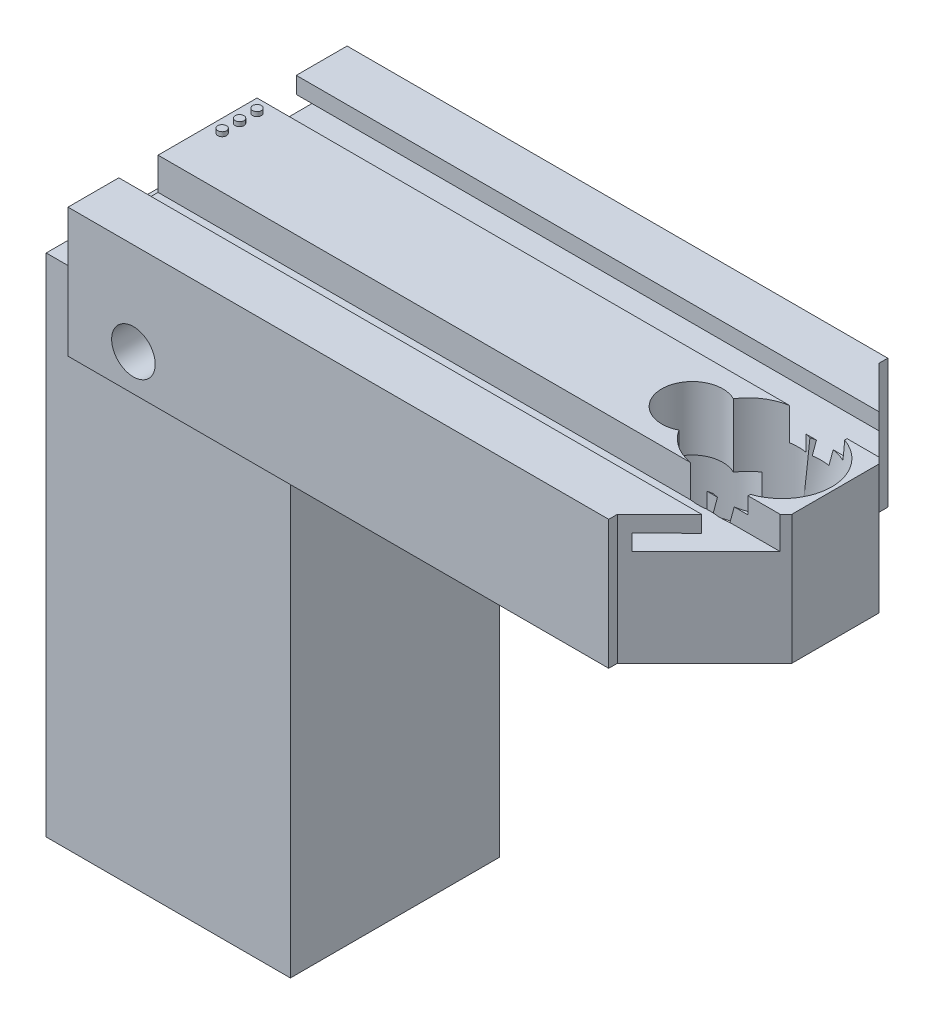
from build123d import *

# Parameters (mm, degrees)
SKETCH1_W               = 47
SKETCH1_H               = 30
BOSS_EXTRUDE1_DEPTH     = 14.8
SKETCH2_R               = 5.75
CUT_EXTRUDE1_DEPTH      = 32.564061843
SKETCH10_W              = 15
SKETCH10_H              = 23
BOSS_EXTRUDE2_DEPTH     = 10
SKETCH9_R               = 2.5
CUT_EXTRUDE2_DEPTH      = 52.780787943
SKETCH9_3_W             = 8.89
SKETCH9_3_H             = 8.382
SKETCH9_3_R             = 2.5
CUT_EXTRUDE3_DEPTH      = 28.04
SKETCH14_W              = 11.152996248
SKETCH14_H              = 9.480152006
BOSS_EXTRUDE3_DEPTH     = 11.96
CUT_EXTRUDE6_DEPTH      = 31
CUT_EXTRUDE6_DEPTH_BACK = 111
SKETCH15_R              = 2.5
CHAMFER1_SIZE           = 10
CUT_EXTRUDE7_DEPTH      = 58.99137867
SKETCH17_W              = 15
SKETCH17_H              = 23
CUT_EXTRUDE8_DEPTH      = 10
CUT_EXTRUDE9_DEPTH      = 31.734725749
CUT_EXTRUDE9_DEPTH_BACK = 31.734725749
SKETCH18_R              = 5.75
CUT_EXTRUDE10_START     = -7.3
SKETCH19_R              = 5.75
CUT_EXTRUDE10_DEPTH     = 25.264061843
SKETCH20_W              = 37
SKETCH20_H              = 14.8
SKETCH20_R              = 2.5
BOSS_EXTRUDE4_DEPTH     = 1
BOSS_EXTRUDE5_START     = 1
SKETCH21_W              = 37
SKETCH21_H              = 14.8
SKETCH21_R              = 2.5
BOSS_EXTRUDE5_DEPTH     = 1
BOSS_EXTRUDE6_DEPTH     = 25
CUT_EXTRUDE11_REACH     = 59.065
SKETCH22_W              = 5.115877125
SKETCH22_H              = 1.9
SKETCH24_R              = 2.5
CUT_EXTRUDE12_DEPTH     = 60.960737154
CUT_EXTRUDE13_START     = -19.04
SKETCH25_W              = 9.4
SKETCH25_H              = 8.9
CUT_EXTRUDE13_DEPTH     = 6.08
SKETCH26_W              = 23.327842288
SKETCH26_H              = 8.382
BOSS_EXTRUDE7_DEPTH     = 32
SKETCH27_R              = 3.5
CUT_EXTRUDE14_DEPTH     = 10
SKETCH28_R              = 0.5
BOSS_EXTRUDE8_DEPTH     = 0.5
SKETCH29_W              = 28
SKETCH29_H              = 24
SKETCH29_W_2            = 19.5
SKETCH29_H_2            = 14.8
BOSS_EXTRUDE9_DEPTH     = 53
SKETCH30_W              = 6.5
SKETCH30_H              = 24
BOSS_EXTRUDE10_DEPTH    = 5


with BuildPart() as part:
    # Sketch1 → Boss-Extrude1 (new body)
    with BuildSketch(Plane(origin=(0, 0, 0), x_dir=(1, 0, 0), z_dir=(0, 1, 0))):
        Rectangle(SKETCH1_W, SKETCH1_H)
    extrude(amount=BOSS_EXTRUDE1_DEPTH)

    # Sketch2 → Cut-Extrude1 (cut, through all)
    with BuildSketch(Plane.XZ):
        with Locations(Location((13.5, 0, 0), (0, 0, 270))):
            Circle(SKETCH2_R)
    extrude(amount=-CUT_EXTRUDE1_DEPTH, mode=Mode.SUBTRACT)

    # Sketch10 → Boss-Extrude2 (add)
    with BuildSketch(Plane.XY.offset(15)):
        with Locations((-16, 11.5)):
            Rectangle(SKETCH10_W, SKETCH10_H)
    extrude(amount=BOSS_EXTRUDE2_DEPTH)

    # Sketch9 → Cut-Extrude2 (cut, through all)
    with BuildSketch(Plane.XY.offset(25)):
        with Locations((-16, 4.191)):
            Circle(SKETCH9_R)
    extrude(amount=-CUT_EXTRUDE2_DEPTH, mode=Mode.SUBTRACT)

    # Sketch9<3> → Cut-Extrude3 (cut)
    with BuildSketch(Plane.XY.offset(25)):
        with Locations((-16, 4.191)):
            Rectangle(SKETCH9_3_W, SKETCH9_3_H)
        with Locations((-16, 4.191)):
            Circle(SKETCH9_3_R, mode=Mode.SUBTRACT)
    extrude(amount=-CUT_EXTRUDE3_DEPTH, mode=Mode.SUBTRACT)

    # Sketch14 → Boss-Extrude3 (add)
    with BuildSketch(Plane.XY.offset(15)):
        with Locations((-17.328151157, 4.740076003)):
            Rectangle(SKETCH14_W, SKETCH14_H)
    extrude(amount=-BOSS_EXTRUDE3_DEPTH)

    # Sketch15 → Cut-Extrude6 (cut, two sides: drawn at the far end of the back side and taken through both)
    with BuildSketch(Plane(origin=(0, 0, -15), x_dir=(-1, 0, 0), z_dir=(0, 0, -1)).offset(-CUT_EXTRUDE6_DEPTH_BACK)):
        with Locations(Location((16, 4.191, 0), (0, 0, 180))):
            Circle(SKETCH15_R)
    extrude(amount=CUT_EXTRUDE6_DEPTH + CUT_EXTRUDE6_DEPTH_BACK, mode=Mode.SUBTRACT)

    # Chamfer1
    chamfer1_edges = [part.edges().sort_by_distance(p)[0] for p in [
        (23.5, 7.4, 15),
        (23.5, 7.4, -15),
    ]]
    chamfer(chamfer1_edges, length=CHAMFER1_SIZE)

    # Sketch16 → Cut-Extrude7 (cut, through all)
    with BuildSketch(Plane.ZY.offset(23.5)):
        Polygon((10.175, 14.8), (10.175, 12.9), (14.174668145, 12.951524082), (14.174999863, 11.101524112), (5.675, 11.1), (5.675, 14.8), align=None)
        Polygon((-14.174999863, 11.101524112), (-5.675, 11.1), (-5.675, 14.8), (-10.175, 14.8), (-10.175, 12.9), (-14.174668145, 12.951524082), align=None)
    extrude(amount=-CUT_EXTRUDE7_DEPTH, mode=Mode.SUBTRACT)

    # Sketch17 → Cut-Extrude8 (cut)
    with BuildSketch(Plane.XY.offset(25)):
        with Locations((-16, 11.5)):
            Rectangle(SKETCH17_W, SKETCH17_H)
    extrude(amount=-CUT_EXTRUDE8_DEPTH, mode=Mode.SUBTRACT)

    # Sketch18 → Cut-Extrude9 (cut, two sides: drawn at the far end of the back side and taken through both)
    with BuildSketch(Plane(origin=(2.125798494, 7.933587988, 0), x_dir=(0, 0, 1), z_dir=(0.25881904510252474, 0.9659258262890673, 0)).offset(-CUT_EXTRUDE9_DEPTH_BACK)):
        with Locations((0, 12.699256918)):
            Circle(SKETCH18_R)
    extrude(amount=CUT_EXTRUDE9_DEPTH + CUT_EXTRUDE9_DEPTH_BACK, mode=Mode.SUBTRACT)

    # Sketch19 → Cut-Extrude10 (cut, through all)
    with BuildSketch(Plane(origin=(0, 14.8, 0), x_dir=(1, 0, 0), z_dir=(0, 1, 0)).offset(CUT_EXTRUDE10_START)):
        with Locations((7.08, 0)):
            Circle(SKETCH19_R)
    extrude(amount=-CUT_EXTRUDE10_DEPTH, mode=Mode.SUBTRACT)

    # Sketch20 → Boss-Extrude4 (add)
    with BuildSketch(Plane.XY.offset(15)):
        with Locations((-5, 7.4)):
            Rectangle(SKETCH20_W, SKETCH20_H)
        with Locations((-16, 4.191)):
            Circle(SKETCH20_R, mode=Mode.SUBTRACT)
    extrude(amount=BOSS_EXTRUDE4_DEPTH)

    # Sketch21 → Boss-Extrude5 (add)
    with BuildSketch(Plane(origin=(0, 0, -15), x_dir=(-1, 0, 0), z_dir=(0, 0, -1)).offset(BOSS_EXTRUDE5_START)):
        with Locations((5, 7.4)):
            Rectangle(SKETCH21_W, SKETCH21_H)
        with Locations(Location((16, 4.191, 0), (0, 0, 180))):
            Circle(SKETCH21_R, mode=Mode.SUBTRACT)
    extrude(amount=-BOSS_EXTRUDE5_DEPTH)

    # Sketch23 → Boss-Extrude6 (add)
    with BuildSketch(Plane.ZY.offset(23.5)):
        Polygon((-10.175, 14.8), (-16, 14.8), (-16, 0), (16, 0), (16, 14.8), (10.175, 14.8), (10.175, 12.9), (14.174668145, 12.951524082), (14.174999863, 11.101524112), (5.675, 11.1), (5.675, 14.8), (-5.675, 14.8), (-5.675, 11.1), (-14.174999863, 11.101524112), (-14.174668145, 12.951524082), (-10.175, 12.9), align=None)
    extrude(amount=BOSS_EXTRUDE6_DEPTH)

    # Cut-Extrude11: up to this face of the body (flat: up to its plane)
    cut_extrude11_end = Plane(part.part.faces().sort_by_distance((-2.5875, 13.85, -10.175))[0])
    # Sketch22 → Cut-Extrude11 (cut, up to the picked face)
    with BuildSketch(Plane(origin=(0, 0, 10.175), x_dir=(-1, 0, 0), z_dir=(0, 0, -1)), mode=Mode.PRIVATE) as cut_extrude11_sk1:
        with Locations((-16.601488732, 13.85)):
            Rectangle(SKETCH22_W, SKETCH22_H)
    cut_extrude11_tool1 = split(extrude(cut_extrude11_sk1.sketch, amount=CUT_EXTRUDE11_REACH, mode=Mode.PRIVATE), bisect_by=cut_extrude11_end, keep=Keep.BOTH, mode=Mode.PRIVATE)
    add(cut_extrude11_tool1.solids().sort_by(Axis((16.601489, 13.85, 10.175), (0, 0, -1)))[0], mode=Mode.SUBTRACT)

    # Sketch24 → Cut-Extrude12 (cut, through all)
    with BuildSketch(Plane.XY.offset(16)):
        with Locations((-41, 4.191)):
            Circle(SKETCH24_R)
    extrude(amount=-CUT_EXTRUDE12_DEPTH, mode=Mode.SUBTRACT)

    # Sketch25 → Cut-Extrude13 (cut)
    with BuildSketch(Plane.XY.offset(16).offset(CUT_EXTRUDE13_START)):
        with Locations((-41, 4.191)):
            Rectangle(SKETCH25_W, SKETCH25_H)
    extrude(amount=CUT_EXTRUDE13_DEPTH, mode=Mode.SUBTRACT)

    # Sketch26 → Boss-Extrude7 (add, through all)
    with BuildSketch(Plane.XY.offset(16)):
        with Locations((-16, 4.191)):
            Rectangle(SKETCH26_W, SKETCH26_H)
    extrude(amount=-BOSS_EXTRUDE7_DEPTH)

    # Sketch27 → Cut-Extrude14 (cut)
    with BuildSketch(Plane.XZ.offset(-7.5)):
        with Locations((7.08, 0)):
            Circle(SKETCH27_R)
    extrude(amount=-CUT_EXTRUDE14_DEPTH, mode=Mode.SUBTRACT)

    # Sketch28 → Boss-Extrude8 (add)
    with BuildSketch(Plane(origin=(0, 14.8, 0), x_dir=(1, 0, 0), z_dir=(0, 1, 0))):
        with Locations(Location((-47, 0.175, 0), (0, 0, 90))):
            Circle(SKETCH28_R)
        with Locations(Location((-47, 2.175, 0), (0, 0, 90))):
            Circle(SKETCH28_R)
        with Locations(Location((-47, 4.175, 0), (0, 0, 90))):
            Circle(SKETCH28_R)
    extrude(amount=BOSS_EXTRUDE8_DEPTH)

    # Sketch29 → Boss-Extrude9 (add)
    with BuildSketch(Plane.XZ):
        with Locations((-41, 0)):
            Rectangle(SKETCH29_W, SKETCH29_H)
        with Locations((-41, 0)):
            Rectangle(SKETCH29_W_2, SKETCH29_H_2, mode=Mode.SUBTRACT)
    extrude(amount=BOSS_EXTRUDE9_DEPTH)

    # Sketch30 → Boss-Extrude10 (add)
    with BuildSketch(Plane(origin=(0, 0, 0), x_dir=(1, 0, 0), z_dir=(0, 1, 0))):
        with Locations((-51.75, 0)):
            Rectangle(SKETCH30_W, SKETCH30_H)
    extrude(amount=BOSS_EXTRUDE10_DEPTH)


solid = part.part
